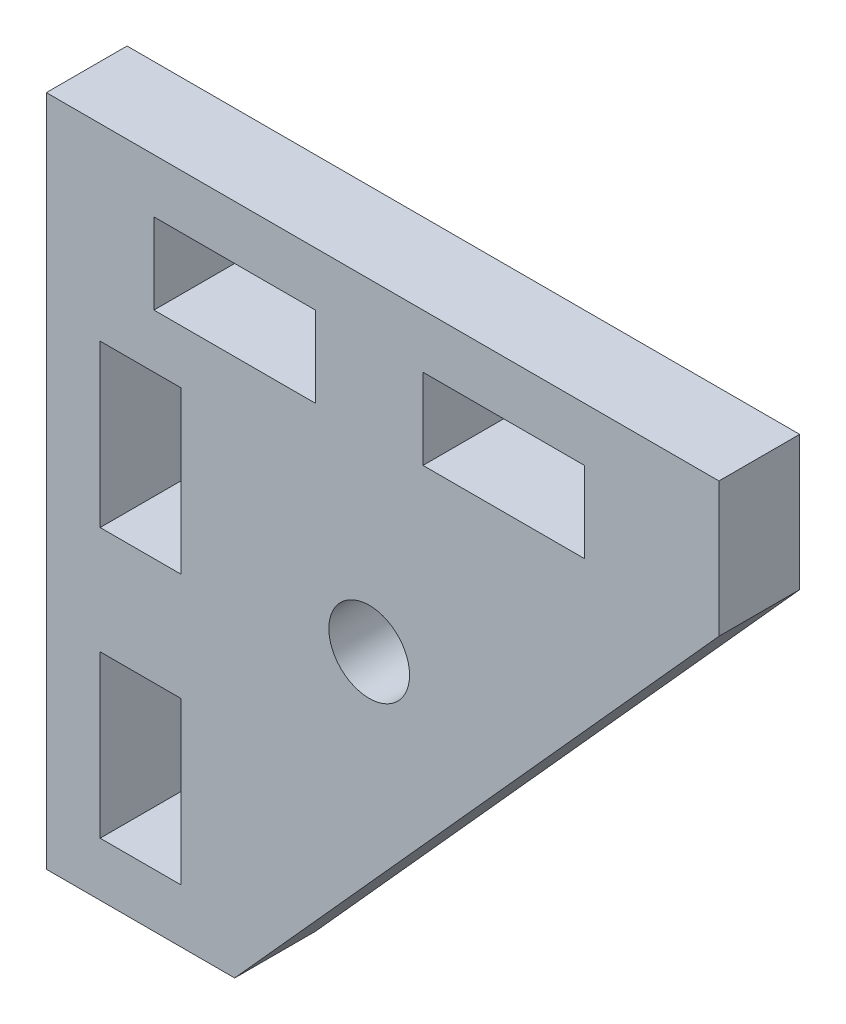
from build123d import *

# Parameters (mm, degrees)
SKETCH_1_W          = 3
SKETCH_1_H          = 6
SKETCH_1_W_2        = 6
SKETCH_1_H_2        = 3
EXTRUDE_1_DEPTH     = 3
SKETCH_2_R          = 1.5
CUT_EXTRUDE_1_DEPTH = 10


with BuildPart() as part:
    # 草图1 → 凸台-拉伸1 (new body)
    with BuildSketch(Plane.XY):
        Polygon((0, 0), (0, -2), (0, -5), (0, -25), (7, -25), (25, -5), (25, 0), align=None)
        with Locations((3.5, -10)):
            Rectangle(SKETCH_1_W, SKETCH_1_H, mode=Mode.SUBTRACT)
        with Locations((3.5, -20)):
            Rectangle(SKETCH_1_W, SKETCH_1_H, mode=Mode.SUBTRACT)
        with Locations((17, -3.5)):
            Rectangle(SKETCH_1_W_2, SKETCH_1_H_2, mode=Mode.SUBTRACT)
        with Locations((7, -3.5)):
            Rectangle(SKETCH_1_W_2, SKETCH_1_H_2, mode=Mode.SUBTRACT)
    extrude(amount=EXTRUDE_1_DEPTH)

    # 草图2 → 切除-拉伸1 (cut)
    with BuildSketch(Plane.XY.offset(3)):
        with Locations((12, -12)):
            Circle(SKETCH_2_R)
    extrude(amount=-CUT_EXTRUDE_1_DEPTH, mode=Mode.SUBTRACT)


solid = part.part
